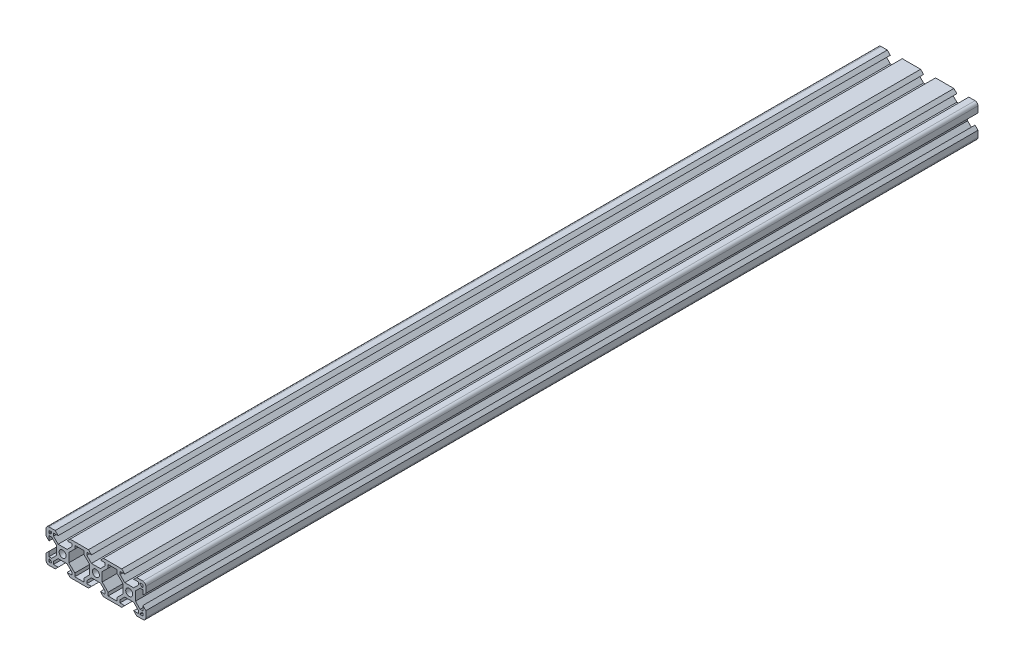
from build123d import *

# Parameters (mm, degrees)
ESQUISSE1_R        = 2.1
BOSS_EXTRU_1_DEPTH = 250


with BuildPart() as part:
    # Esquisse1 → Boss.-Extru.1 (new, symmetric)
    with BuildSketch(Plane.XY):
        with BuildLine():
            Line((-20, 3.750660172), (-22.69, 3.750660172))
            Line((-22.69, 3.750660172), (-25.499339828, 6.56))
            Line((-25.499339828, 6.56), (-25.499339828, 8.2))
            Line((-25.499339828, 8.2), (-22.69, 8.2))
            Line((-22.69, 8.2), (-24.49, 10))
            Line((-24.49, 10), (-28.2, 10))
            ThreePointArc((-28.2, 10), (-29.472792206, 9.472792206), (-30, 8.2))
            Line((-30, 8.2), (-30, 4.49))
            Line((-30, 4.49), (-28.2, 2.69))
            Line((-28.2, 2.69), (-28.2, 5.499339828))
            Line((-28.2, 5.499339828), (-26.56, 5.499339828))
            Line((-26.56, 5.499339828), (-23.750660172, 2.69))
            Line((-23.750660172, 2.69), (-23.750660172, 0))
            Line((-23.750660172, 0), (-23.750660172, -2.69))
            Line((-23.750660172, -2.69), (-26.56, -5.499339828))
            Line((-26.56, -5.499339828), (-28.2, -5.499339828))
            Line((-28.2, -5.499339828), (-28.2, -2.69))
            Line((-28.2, -2.69), (-30, -4.49))
            Line((-30, -4.49), (-30, -8.2))
            ThreePointArc((-30, -8.2), (-29.472792206, -9.472792206), (-28.2, -10))
            Line((-28.2, -10), (-24.49, -10))
            Line((-24.49, -10), (-22.69, -8.2))
            Line((-22.69, -8.2), (-25.499339828, -8.2))
            Line((-25.499339828, -8.2), (-25.499339828, -6.56))
            Line((-25.499339828, -6.56), (-22.69, -3.750660172))
            Line((-22.69, -3.750660172), (-20, -3.750660172))
            Line((-20, -3.750660172), (-17.31, -3.750660172))
            Line((-17.31, -3.750660172), (-14.500660172, -6.56))
            Line((-14.500660172, -6.56), (-14.500660172, -8.2))
            Line((-14.500660172, -8.2), (-17.31, -8.2))
            Line((-17.31, -8.2), (-15.51, -10))
            Line((-15.51, -10), (-4.49, -10))
            Line((-4.49, -10), (-2.69, -8.2))
            Line((-2.69, -8.2), (-5.499339828, -8.2))
            Line((-5.499339828, -8.2), (-5.499339828, -6.56))
            Line((-5.499339828, -6.56), (-2.69, -3.750660172))
            Line((-2.69, -3.750660172), (2.69, -3.750660172))
            Line((2.69, -3.750660172), (5.499339828, -6.56))
            Line((5.499339828, -6.56), (5.499339828, -8.2))
            Line((5.499339828, -8.2), (2.69, -8.2))
            Line((2.69, -8.2), (4.49, -10))
            Line((4.49, -10), (15.51, -10))
            Line((15.51, -10), (17.31, -8.2))
            Line((17.31, -8.2), (14.500660172, -8.2))
            Line((14.500660172, -8.2), (14.500660172, -6.56))
            Line((14.500660172, -6.56), (17.31, -3.750660172))
            Line((17.31, -3.750660172), (20, -3.750660172))
            Line((20, -3.750660172), (22.69, -3.750660172))
            Line((22.69, -3.750660172), (25.499339828, -6.56))
            Line((25.499339828, -6.56), (25.499339828, -8.2))
            Line((25.499339828, -8.2), (22.69, -8.2))
            Line((22.69, -8.2), (24.49, -10))
            Line((24.49, -10), (28.2, -10))
            ThreePointArc((28.2, -10), (29.472792206, -9.472792206), (30, -8.2))
            Line((30, -8.2), (30, -4.49))
            Line((30, -4.49), (28.2, -2.69))
            Line((28.2, -2.69), (28.2, -5.499339828))
            Line((28.2, -5.499339828), (26.56, -5.499339828))
            Line((26.56, -5.499339828), (23.750660172, -2.69))
            Line((23.750660172, -2.69), (23.750660172, 0))
            Line((23.750660172, 0), (23.750660172, 2.69))
            Line((23.750660172, 2.69), (26.56, 5.499339828))
            Line((26.56, 5.499339828), (28.2, 5.499339828))
            Line((28.2, 5.499339828), (28.2, 2.69))
            Line((28.2, 2.69), (30, 4.49))
            Line((30, 4.49), (30, 8.2))
            ThreePointArc((30, 8.2), (29.472792206, 9.472792206), (28.2, 10))
            Line((28.2, 10), (24.49, 10))
            Line((24.49, 10), (22.69, 8.2))
            Line((22.69, 8.2), (25.499339828, 8.2))
            Line((25.499339828, 8.2), (25.499339828, 6.56))
            Line((25.499339828, 6.56), (22.69, 3.750660172))
            Line((22.69, 3.750660172), (20, 3.750660172))
            Line((20, 3.750660172), (17.31, 3.750660172))
            Line((17.31, 3.750660172), (14.500660172, 6.56))
            Line((14.500660172, 6.56), (14.500660172, 8.2))
            Line((14.500660172, 8.2), (17.31, 8.2))
            Line((17.31, 8.2), (15.51, 10))
            Line((15.51, 10), (4.49, 10))
            Line((4.49, 10), (2.69, 8.2))
            Line((2.69, 8.2), (5.499339828, 8.2))
            Line((5.499339828, 8.2), (5.499339828, 6.56))
            Line((5.499339828, 6.56), (2.69, 3.750660172))
            Line((2.69, 3.750660172), (-2.69, 3.750660172))
            Line((-2.69, 3.750660172), (-5.499339828, 6.56))
            Line((-5.499339828, 6.56), (-5.499339828, 8.2))
            Line((-5.499339828, 8.2), (-2.69, 8.2))
            Line((-2.69, 8.2), (-4.49, 10))
            Line((-4.49, 10), (-15.51, 10))
            Line((-15.51, 10), (-17.31, 8.2))
            Line((-17.31, 8.2), (-14.500660172, 8.2))
            Line((-14.500660172, 8.2), (-14.500660172, 6.56))
            Line((-14.500660172, 6.56), (-17.31, 3.750660172))
            Line((-17.31, 3.750660172), (-20, 3.750660172))
        make_face()
        Circle(ESQUISSE1_R, mode=Mode.SUBTRACT)
        with Locations((-20, 0)):
            Circle(ESQUISSE1_R, mode=Mode.SUBTRACT)
        with Locations((20, 0)):
            Circle(ESQUISSE1_R, mode=Mode.SUBTRACT)
        Polygon((-28.2, 8.2), (-28.2, 6.569339828), (-27.63, 6.569339828), (-26.569339828, 7.63), (-26.569339828, 8.2), align=None, mode=Mode.SUBTRACT)
        Polygon((-26.569339828, -7.63), (-27.63, -6.569339828), (-28.2, -6.569339828), (-28.2, -8.2), (-26.569339828, -8.2), align=None, mode=Mode.SUBTRACT)
        Polygon((-7.300660172, -8.2), (-7.300660172, -6.24), (-3.750660172, -2.69), (-3.750660172, 2.69), (-7.300660172, 6.24), (-7.300660172, 8.2), (-12.699339828, 8.2), (-12.699339828, 6.24), (-16.249339828, 2.69), (-16.249339828, -2.69), (-12.699339828, -6.24), (-12.699339828, -8.2), align=None, mode=Mode.SUBTRACT)
        Polygon((26.569339828, 8.2), (28.2, 8.2), (28.2, 6.569339828), (27.63, 6.569339828), (26.569339828, 7.63), align=None, mode=Mode.SUBTRACT)
        Polygon((26.569339828, -8.2), (26.569339828, -7.63), (27.63, -6.569339828), (28.2, -6.569339828), (28.2, -8.2), align=None, mode=Mode.SUBTRACT)
        Polygon((7.300660172, 8.2), (7.300660172, 6.24), (3.750660172, 2.69), (3.750660172, -2.69), (7.300660172, -6.24), (7.300660172, -8.2), (12.699339828, -8.2), (12.699339828, -6.24), (16.249339828, -2.69), (16.249339828, 2.69), (12.699339828, 6.24), (12.699339828, 8.2), align=None, mode=Mode.SUBTRACT)
    extrude(amount=BOSS_EXTRU_1_DEPTH, both=True)


solid = part.part
